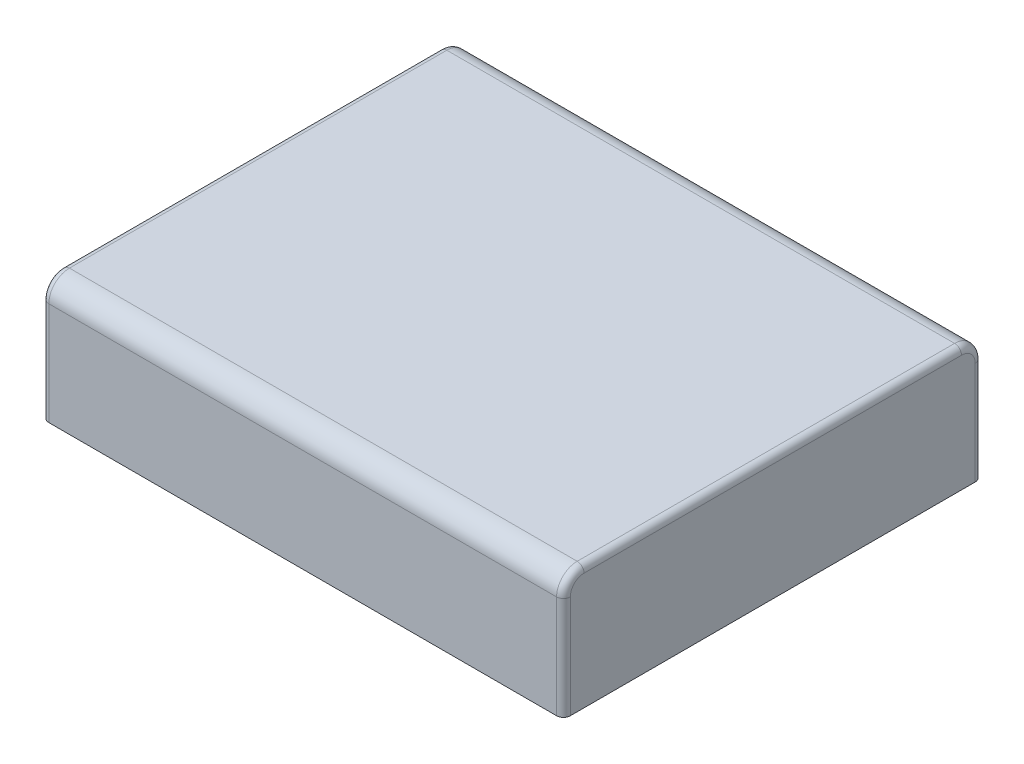
from build123d import *

# Parameters (mm, degrees)
SKETCH_1_W      = 76
SKETCH_1_H      = 61
EXTRUDE_1_DEPTH = 18
FILLET_1_R      = 3
FILLET_2_R      = 1


with BuildPart() as part:
    # 草圖1 → 填料-伸長1 (new body)
    with BuildSketch(Plane(origin=(0, 0, 0), x_dir=(1, 0, 0), z_dir=(0, 1, 0))):
        Rectangle(SKETCH_1_W, SKETCH_1_H)
    extrude(amount=EXTRUDE_1_DEPTH)

    # 圓角1
    fillet_1_edges = [part.edges().sort_by_distance(p)[0] for p in [
        (0, 18, 30.5),
        (0, 18, -30.5),
    ]]
    fillet(fillet_1_edges, radius=FILLET_1_R)

    # 圓角2
    fillet_2_edges = [part.edges().sort_by_distance(p)[0] for p in [
        (38, 18, 0),
        (-38, 18, 0),
        (38, 7.5, -30.5),
        (38, 7.5, 30.5),
        (38, 17.121320344, -29.621320344),
        (38, 17.121320344, 29.621320344),
        (-38, 7.5, 30.5),
        (-38, 7.5, -30.5),
        (-38, 17.121320344, -29.621320344),
        (-38, 17.121320344, 29.621320344),
    ]]
    fillet(fillet_2_edges, radius=FILLET_2_R)


solid = part.part
